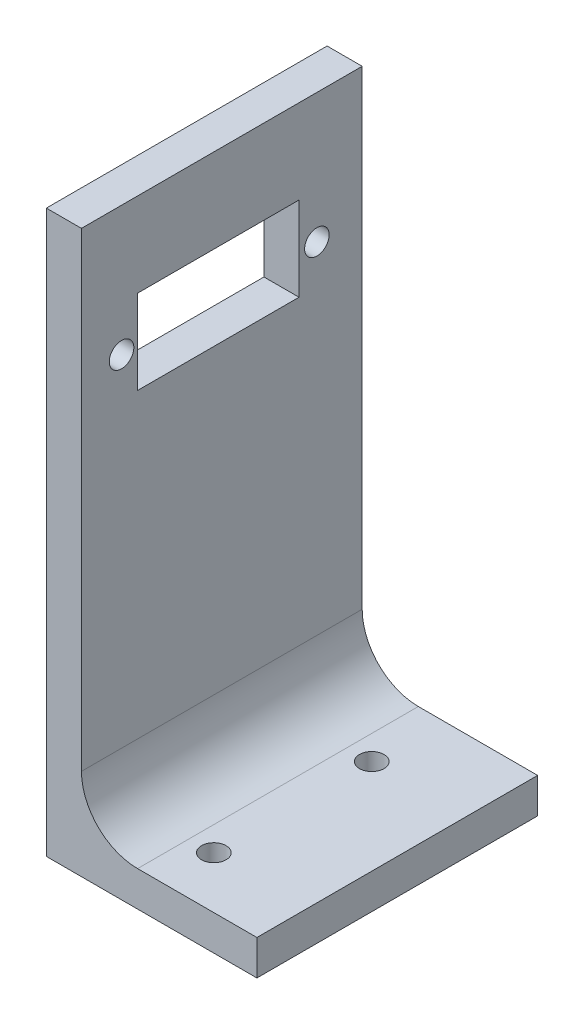
from build123d import *

# Parameters (mm, degrees)
RESSALTO_EXTRUS_O1_DEPTH                   = 40
BROCA_DE_ROSQUEAR_PARA_HELICOIDE_M31_D     = 3.5
BROCA_DE_ROSQUEAR_PARA_HELICOIDE_M31_DEPTH = 10
BROCA_DE_ROSQUEAR_PARA_HELICOIDE_M31_TIP   = 1.051506083
FILETE1_R                                  = 8
ESBO_O6_W                                  = 23
ESBO_O6_H                                  = 12
CORTE_EXTRUS_O1_DEPTH                      = 10
BROCA_DE_ROSQUEAR_PARA_HELICOIDE_M33_D     = 3.5
BROCA_DE_ROSQUEAR_PARA_HELICOIDE_M33_DEPTH = 10
BROCA_DE_ROSQUEAR_PARA_HELICOIDE_M33_TIP   = 1.051506083


with BuildPart() as part:
    # Esboço1 → Ressalto-extrusão1 (new body)
    with BuildSketch(Plane.XY):
        Polygon((-30, 40.02617801), (-30, -39.97382199), (0, -39.97382199), (0, -34.97382199), (-25, -34.97382199), (-25, 40.02617801), align=None)
    extrude(amount=RESSALTO_EXTRUS_O1_DEPTH)

    # Broca de rosquear para helicoide M31
    with Locations(Plane(origin=(0, -34.97382199, 0), x_dir=(1, 0, 0), z_dir=(0, 1, 0))):
        with Locations((-13.529029312, -32.612904954), (-13.529029312, -10.11076891)):
            Hole(BROCA_DE_ROSQUEAR_PARA_HELICOIDE_M31_D / 2, depth=BROCA_DE_ROSQUEAR_PARA_HELICOIDE_M31_DEPTH)
            with Locations((0, 0, -(BROCA_DE_ROSQUEAR_PARA_HELICOIDE_M31_DEPTH + BROCA_DE_ROSQUEAR_PARA_HELICOIDE_M31_TIP / 2))):  # 118° drill point
                Cone(0, BROCA_DE_ROSQUEAR_PARA_HELICOIDE_M31_D / 2, BROCA_DE_ROSQUEAR_PARA_HELICOIDE_M31_TIP, mode=Mode.SUBTRACT)

    # Filete1
    filete1_edges = [part.edges().sort_by_distance(p)[0] for p in [
        (-25, -34.97382199, 20),
    ]]
    fillet(filete1_edges, radius=FILETE1_R)

    # Esboço6 → Corte-extrusão1 (cut)
    with BuildSketch(Plane(origin=(-25, 0, 0), x_dir=(0, 0, -1), z_dir=(1, 0, 0))):
        with Locations((-20.5, 22.02617801)):
            Rectangle(ESBO_O6_W, ESBO_O6_H)
    extrude(amount=-CORTE_EXTRUS_O1_DEPTH, mode=Mode.SUBTRACT)

    # Broca de rosquear para helicoide M33
    with Locations(Plane(origin=(-25, 0, 0), x_dir=(0, 0, -1), z_dir=(1, 0, 0))):
        with Locations((-6.454548455, 21.588594031), (-34.28528994, 21.588594031)):
            Hole(BROCA_DE_ROSQUEAR_PARA_HELICOIDE_M33_D / 2, depth=BROCA_DE_ROSQUEAR_PARA_HELICOIDE_M33_DEPTH)
            with Locations((0, 0, -(BROCA_DE_ROSQUEAR_PARA_HELICOIDE_M33_DEPTH + BROCA_DE_ROSQUEAR_PARA_HELICOIDE_M33_TIP / 2))):  # 118° drill point
                Cone(0, BROCA_DE_ROSQUEAR_PARA_HELICOIDE_M33_D / 2, BROCA_DE_ROSQUEAR_PARA_HELICOIDE_M33_TIP, mode=Mode.SUBTRACT)


solid = part.part
